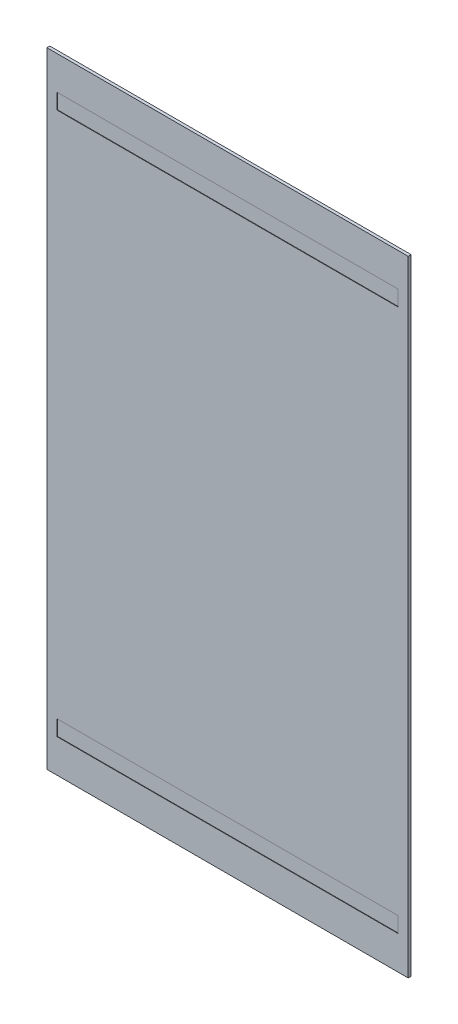
from build123d import *

# Parameters (mm, degrees)
SKETCH1_W          = 37
SKETCH1_H          = 64
EXTRUDE1_DEPTH     = 0.3
SKETCH2_W          = 34.925
SKETCH2_H          = 1.5875
CUT_EXTRUDE1_DEPTH = 0.05


with BuildPart() as part:
    # Sketch1 → Extrude1 (new body)
    with BuildSketch(Plane.XY):
        Rectangle(SKETCH1_W, SKETCH1_H)
    extrude(amount=EXTRUDE1_DEPTH)

    # Sketch2 → Cut-Extrude1 (cut)
    with BuildSketch(Plane.XY.offset(0.3)):
        with Locations((0, 27.78125)):
            Rectangle(SKETCH2_W, SKETCH2_H)
        with Locations((0, -27.78125)):
            Rectangle(SKETCH2_W, SKETCH2_H)
    extrude(amount=-CUT_EXTRUDE1_DEPTH, mode=Mode.SUBTRACT)


solid = part.part
